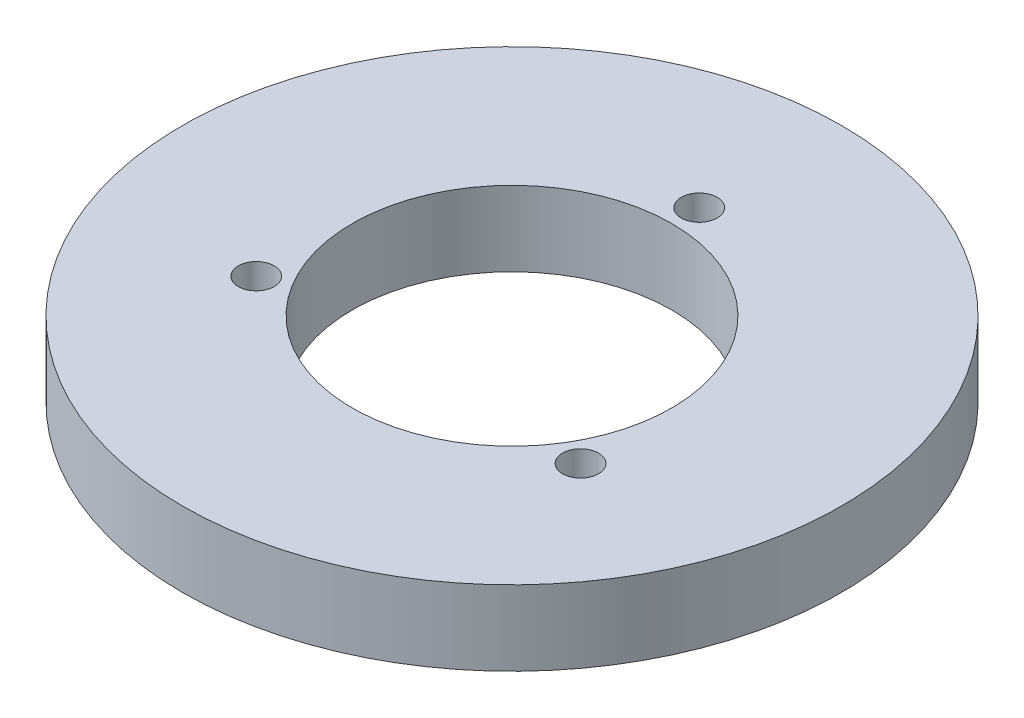
from build123d import *

# Parameters (mm, degrees)
SKETCH1_R           = 41.91
SKETCH1_R_2         = 20.32
BOSS_EXTRUDE1_DEPTH = 9.525
SKETCH2_R           = 2.286
CUT_EXTRUDE1_DEPTH  = 61.030174288


with BuildPart() as part:
    # Sketch1 → Boss-Extrude1 (new body)
    with BuildSketch(Plane(origin=(0, 0, 0), x_dir=(1, 0, 0), z_dir=(0, 1, 0))):
        with Locations(Location((0, 0, 0), (0, 0, 90))):
            Circle(SKETCH1_R)
        with Locations(Location((0, 0, 0), (0, 0, 90))):
            Circle(SKETCH1_R_2, mode=Mode.SUBTRACT)
    extrude(amount=BOSS_EXTRUDE1_DEPTH)

    # Sketch2 → Cut-Extrude1 (cut, through all)
    with BuildSketch(Plane(origin=(0, 9.525, 0), x_dir=(1, 0, 0), z_dir=(0, 1, 0))):
        with Locations(Location((0, 23.8125, 0), (0, 0, 270))):
            Circle(SKETCH2_R)
        with Locations(Location((20.622229928, -11.90625, 0), (0, 0, 270))):
            Circle(SKETCH2_R)
        with Locations(Location((-20.622229928, -11.90625, 0), (0, 0, 270))):
            Circle(SKETCH2_R)
    extrude(amount=-CUT_EXTRUDE1_DEPTH, mode=Mode.SUBTRACT)


solid = part.part
